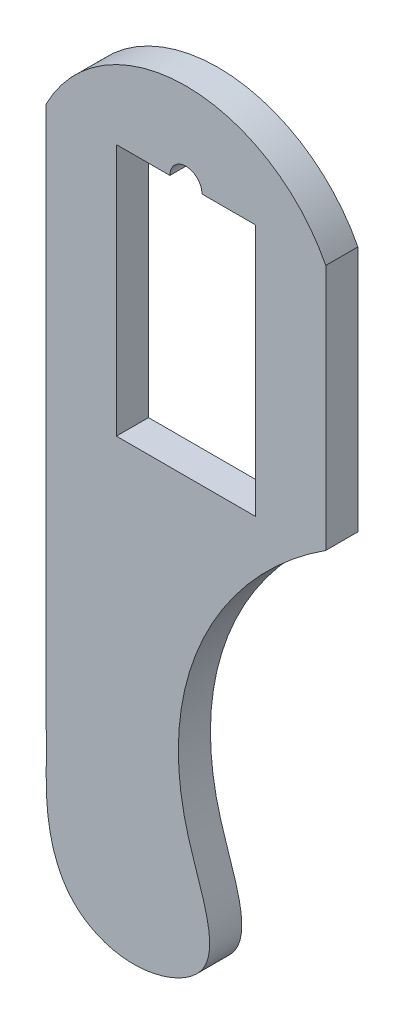
from build123d import *

# Parameters (mm, degrees)
BOSS_EXTRUDE1_DEPTH = 3


with BuildPart() as part:
    # Sketch1 → Boss-Extrude1 (new body)
    with BuildSketch(Plane.XY):
        with BuildLine():
            Line((-13.069, 11.8), (-13.069, -38.2))
            add(Edge.make_bspline(
                [(-13.069, -38.2), (-12.951036572, -40.954332513), (-13.463205261, -45.395669498), (-11.170112762, -52.050230149), (-4.841850209, -54.786907754), (4.624670056, -50.925199711), (-5.382779946, -31.82964729), (3.799759411, -17.227746281), (13.069, -11.269243397)],
                knots=[0, 0, 0, 0, 0.116411248, 0.189880729, 0.27926021, 0.381967403, 0.527063868, 1, 1, 1, 1], degree=3))
            Line((13.069, -11.269243397), (13.069, -11.213387283))
            Line((13.069, -11.213387283), (13.069, 11.8))
            ThreePointArc((13.069, 11.8), (0, 19.8), (-13.069, 11.8))
        make_face()
        with BuildLine():
            Line((-6.5, 11.8), (-1.5, 11.8))
            ThreePointArc((-1.5, 11.8), (0, 13.3), (1.5, 11.8))
            Line((1.5, 11.8), (6.5, 11.8))
            Line((6.5, 11.8), (6.5, -11.8))
            Line((6.5, -11.8), (-6.5, -11.8))
            Line((-6.5, -11.8), (-6.5, 11.8))
        make_face(mode=Mode.SUBTRACT)
    extrude(amount=BOSS_EXTRUDE1_DEPTH)


solid = part.part
